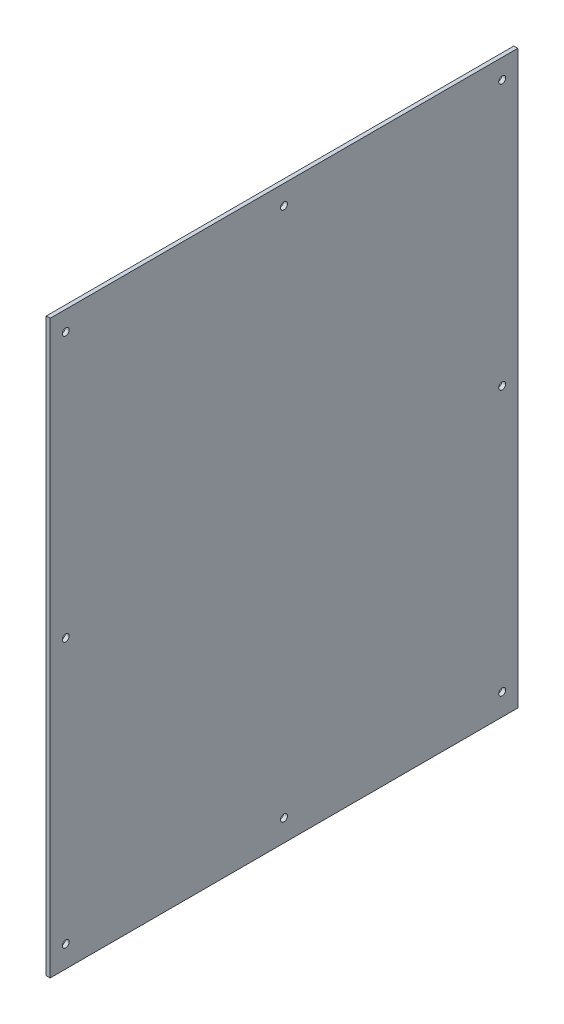
from build123d import *

# Parameters (mm, degrees)
SKETCH1_W           = 5
SKETCH1_H           = 375
SKETCH1_W_2         = 450
SKETCH1_R           = 2.8
SKETCH1_W_3         = 3.175
BOSS_EXTRUDE1_DEPTH = 3.175


with BuildPart() as part:
    # Sketch1 → Boss-Extrude1 (new body)
    # profile 1 of 3: a face of its own
    with BuildSketch(Plane.YZ):
        with Locations((-227.5, 0)):
            Rectangle(SKETCH1_W, SKETCH1_H)
    # profile 2 of 3: a face of its own
    with BuildSketch(Plane.YZ):
        Rectangle(SKETCH1_W_2, SKETCH1_H)
        with Locations(Location((-212.5, 0, 0), (0, 0, 270))):
            Circle(SKETCH1_R, mode=Mode.SUBTRACT)
        with Locations(Location((212.5, 0, 0), (0, 0, 270))):
            Circle(SKETCH1_R, mode=Mode.SUBTRACT)
        with Locations(Location((0, 175, 0), (0, 0, 270))):
            Circle(SKETCH1_R, mode=Mode.SUBTRACT)
        with Locations(Location((0, -175, 0), (0, 0, 270))):
            Circle(SKETCH1_R, mode=Mode.SUBTRACT)
        with Locations(Location((-212.5, -175, 0), (0, 0, 270))):
            Circle(SKETCH1_R, mode=Mode.SUBTRACT)
        with Locations(Location((212.5, -175, 0), (0, 0, 270))):
            Circle(SKETCH1_R, mode=Mode.SUBTRACT)
        with Locations(Location((212.5, 175, 0), (0, 0, 270))):
            Circle(SKETCH1_R, mode=Mode.SUBTRACT)
        with Locations(Location((-212.5, 175, 0), (0, 0, 270))):
            Circle(SKETCH1_R, mode=Mode.SUBTRACT)
    # profile 3 of 3: a face of its own
    with BuildSketch(Plane.YZ):
        with Locations((226.5875, 0)):
            Rectangle(SKETCH1_W_3, SKETCH1_H)
    extrude(amount=BOSS_EXTRUDE1_DEPTH)


solid = part.part
